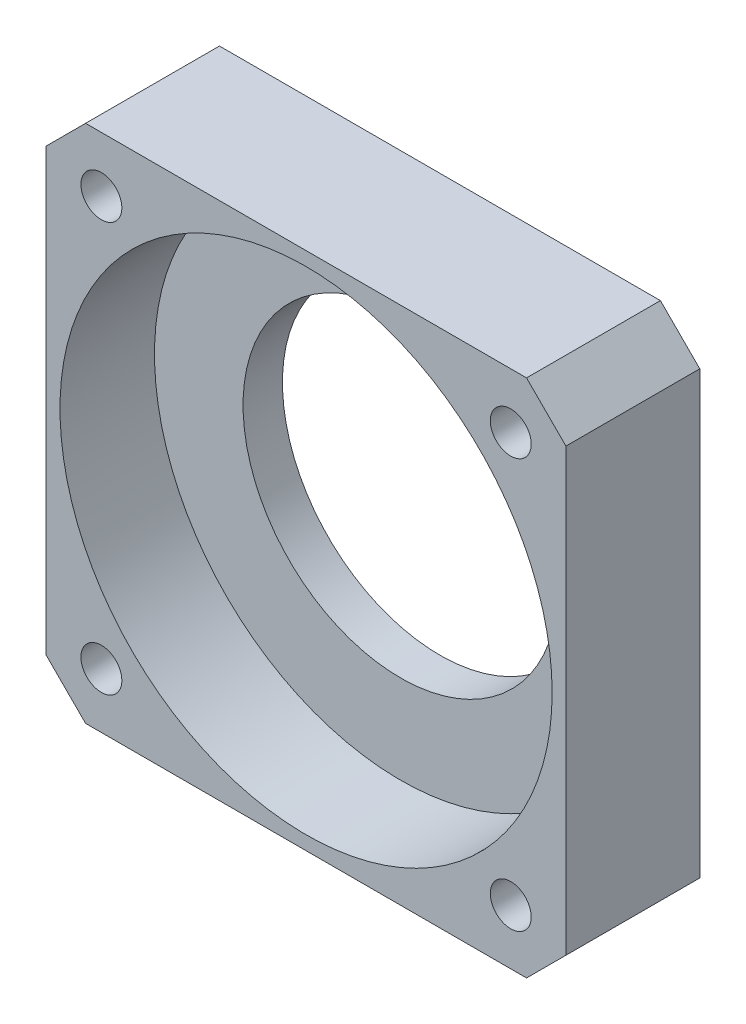
from build123d import *

# Parameters (mm, degrees)
SKETCH1_W           = 41.91
SKETCH1_H           = 41.91
SKETCH1_R           = 1.64973
SKETCH1_R_2         = 12.7
BOSS_EXTRUDE1_DEPTH = 10.795
SKETCH3_R           = 19.84375
CUT_EXTRUDE2_DEPTH  = 7.62
CHAMFER1_SIZE       = 3.175


with BuildPart() as part:
    # Sketch1 → Boss-Extrude1 (new body)
    with BuildSketch(Plane.XY):
        with Locations((20.955, 20.955)):
            Rectangle(SKETCH1_W, SKETCH1_H)
        with Locations((37.460710751, 37.460710751)):
            Circle(SKETCH1_R, mode=Mode.SUBTRACT)
        with Locations((37.460710751, 4.449289249)):
            Circle(SKETCH1_R, mode=Mode.SUBTRACT)
        with Locations((4.449289249, 4.449289249)):
            Circle(SKETCH1_R, mode=Mode.SUBTRACT)
        with Locations((4.449289249, 37.460710751)):
            Circle(SKETCH1_R, mode=Mode.SUBTRACT)
        with Locations((20.955, 20.955)):
            Circle(SKETCH1_R_2, mode=Mode.SUBTRACT)
    extrude(amount=BOSS_EXTRUDE1_DEPTH)

    # Sketch3 → Cut-Extrude2 (cut)
    with BuildSketch(Plane.XY.offset(10.795)):
        with Locations((20.955, 20.955)):
            Circle(SKETCH3_R)
    extrude(amount=-CUT_EXTRUDE2_DEPTH, mode=Mode.SUBTRACT)

    # Chamfer1
    chamfer1_edges = [part.edges().sort_by_distance(p)[0] for p in [
        (0, 41.91, 5.3975),
        (41.91, 41.91, 5.3975),
        (41.91, 0, 5.3975),
        (0, 0, 5.3975),
    ]]
    chamfer(chamfer1_edges, length=CHAMFER1_SIZE)


solid = part.part
